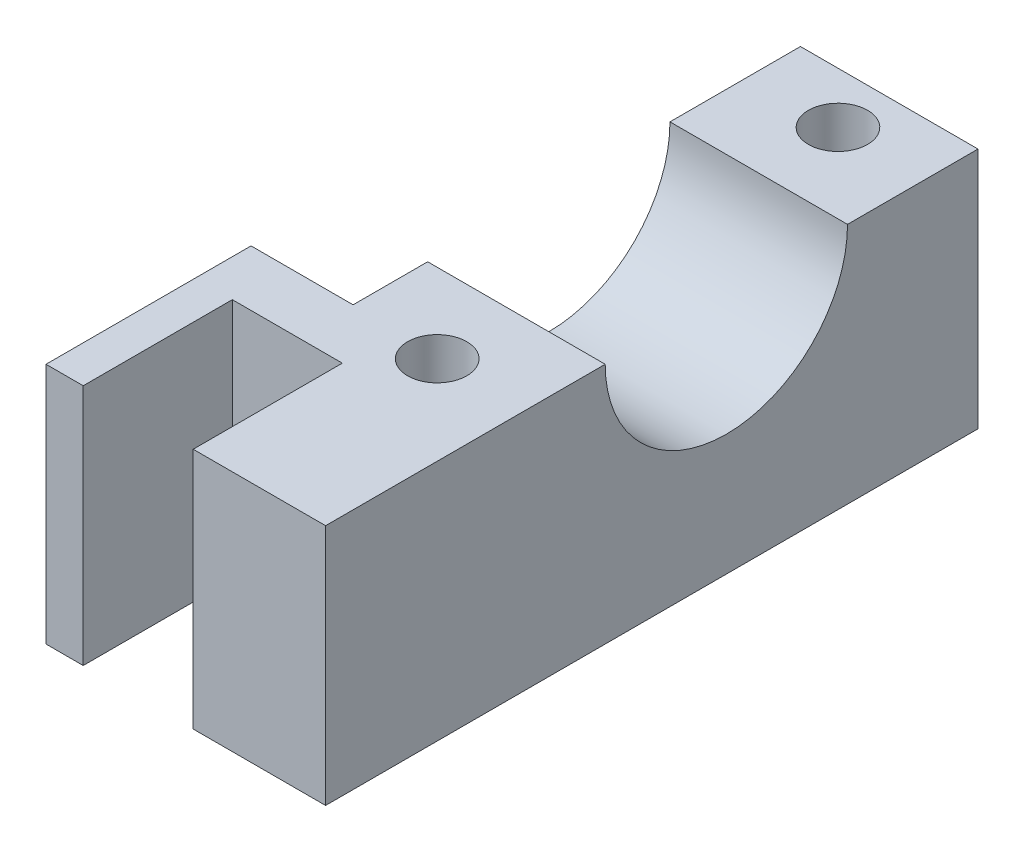
from build123d import *

# Parameters (mm, degrees)
BOSS_EXTRUDE1_DEPTH = 15
SKETCH4_R           = 1.5875
CUT_EXTRUDE2_DEPTH  = 25.005207768
SKETCH6_W           = 7.103151839
SKETCH6_H           = 13
SKETCH6_W_2         = 1.996848161
BOSS_EXTRUDE2_DEPTH = 8
SKETCH7_W           = 5.475
SKETCH7_H           = 24
CUT_EXTRUDE3_DEPTH  = 30.261749777


with BuildPart() as part:
    # Sketch1 → Boss-Extrude1 (new body)
    with BuildSketch(Plane(origin=(0, 0, 0), x_dir=(0, 0, -1), z_dir=(1, 0, 0))):
        with BuildLine():
            Line((6.5, 0), (13.5, 0))
            Line((13.5, 0), (13.5, -13))
            Line((13.5, -13), (-13.5, -13))
            Line((-13.5, -13), (-13.5, 0))
            Line((-13.5, 0), (-6.5, 0))
            ThreePointArc((-6.5, 0), (0, -6.5), (6.5, 0))
        make_face()
    extrude(amount=BOSS_EXTRUDE1_DEPTH)

    # Sketch4 → Cut-Extrude2 (cut, through all)
    with BuildSketch(Plane.XZ.offset(13)):
        with Locations(Location((10.2375, -10.75, 0), (0, 0, 270))):
            Circle(SKETCH4_R)
        with Locations(Location((10.2375, 10.75, 0), (0, 0, 270))):
            Circle(SKETCH4_R)
    extrude(amount=-CUT_EXTRUDE2_DEPTH, mode=Mode.SUBTRACT)

    # Sketch6 → Boss-Extrude2 (add)
    with BuildSketch(Plane.XY.offset(13.5)):
        with Locations((11.448424081, -6.5)):
            Rectangle(SKETCH6_W, SKETCH6_H)
        with Locations((0.998424081, -6.5)):
            Rectangle(SKETCH6_W_2, SKETCH6_H)
    extrude(amount=BOSS_EXTRUDE2_DEPTH)

    # Sketch7 → Cut-Extrude3 (cut, through all)
    with BuildSketch(Plane(origin=(0, 0, 0), x_dir=(1, 0, 0), z_dir=(0, 1, 0))):
        with Locations((2.7375, 1.5)):
            Rectangle(SKETCH7_W, SKETCH7_H)
    extrude(amount=-CUT_EXTRUDE3_DEPTH, mode=Mode.SUBTRACT)


solid = part.part
